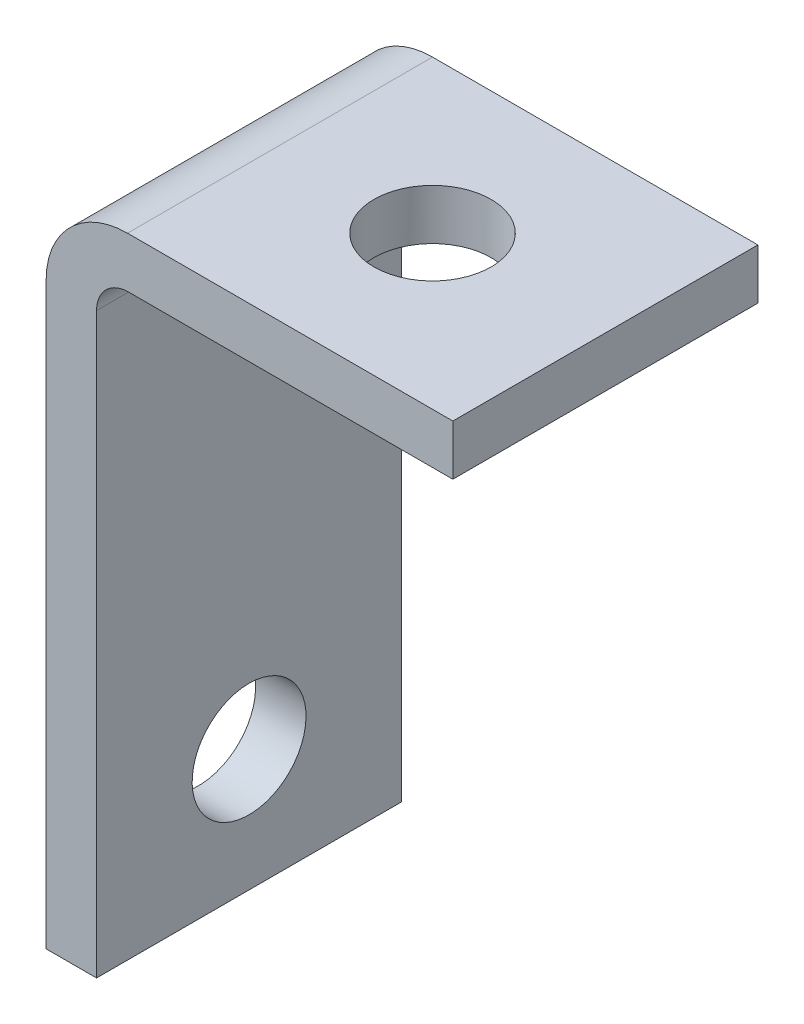
from build123d import *

# Parameters (mm, degrees)
BOSS_EXTRUDE1_DEPTH = 9.525
FILLET1_R           = 1
FILLET2_R           = 2.54
SKETCH2_R           = 1.778
CUT_EXTRUDE1_DEPTH  = 26.295811414
SKETCH3_R           = 1.8288
CUT_EXTRUDE2_DEPTH  = 27.026870731


with BuildPart() as part:
    # Sketch1 → Boss-Extrude1 (new body)
    with BuildSketch(Plane.XY):
        Polygon((0, 0), (0, 20.6248), (12.7, 20.6248), (12.7, 19.05), (1.5748, 19.05), (1.5748, 0), align=None)
    extrude(amount=BOSS_EXTRUDE1_DEPTH)

    # Fillet1
    fillet1_edges = [part.edges().sort_by_distance(p)[0] for p in [
        (1.5748, 19.05, 4.7625),
    ]]
    fillet(fillet1_edges, radius=FILLET1_R)

    # Fillet2
    fillet2_edges = [part.edges().sort_by_distance(p)[0] for p in [
        (0, 20.6248, 4.7625),
    ]]
    fillet(fillet2_edges, radius=FILLET2_R)

    # Sketch2 → Cut-Extrude1 (cut, through all)
    with BuildSketch(Plane(origin=(1.5748, 0, 0), x_dir=(0, 0, -1), z_dir=(1, 0, 0))):
        with Locations(Location((-4.7625, 3.81, 0), (0, 0, 90))):
            Circle(SKETCH2_R)
    extrude(amount=-CUT_EXTRUDE1_DEPTH, mode=Mode.SUBTRACT)

    # Sketch3 → Cut-Extrude2 (cut, through all)
    with BuildSketch(Plane(origin=(0, 20.6248, 0), x_dir=(1, 0, 0), z_dir=(0, 1, 0))):
        with Locations(Location((7.3025, -4.7625, 0), (0, 0, 270))):
            Circle(SKETCH3_R)
    extrude(amount=-CUT_EXTRUDE2_DEPTH, mode=Mode.SUBTRACT)


solid = part.part
